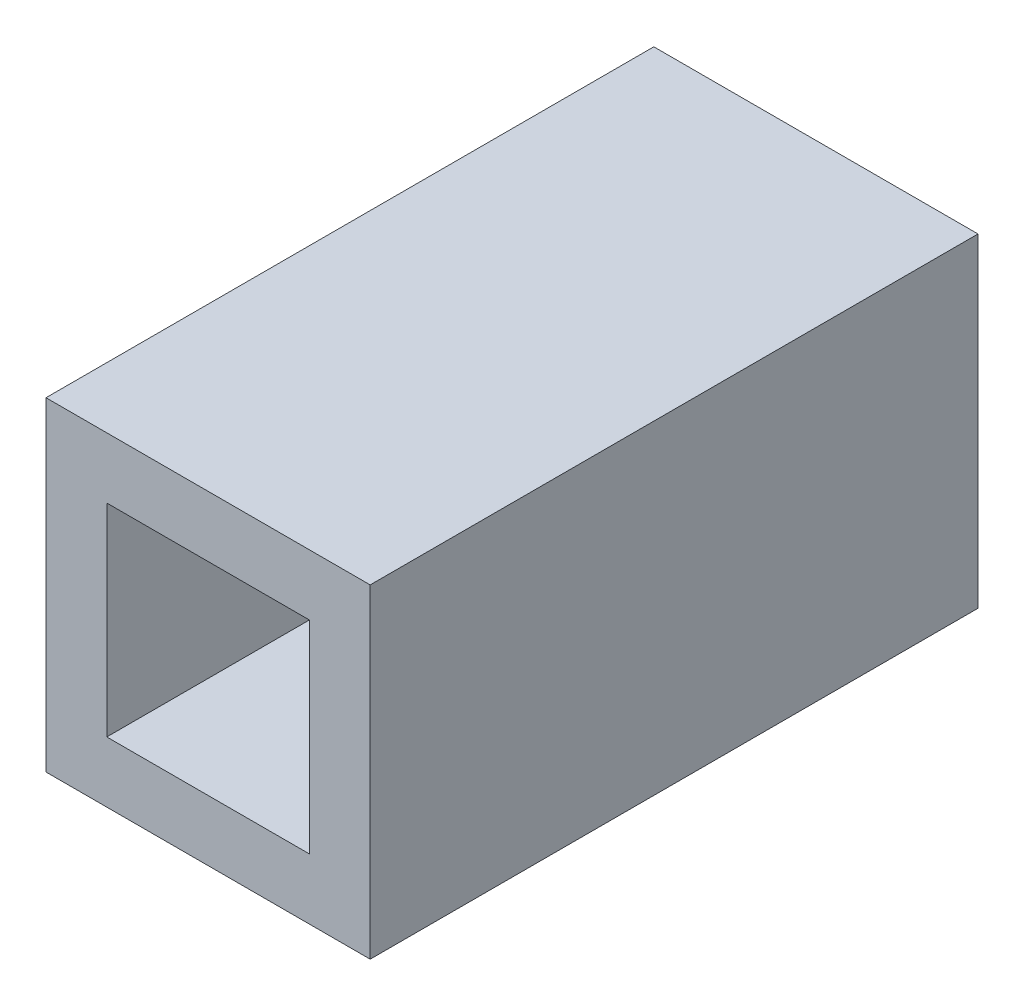
from build123d import *

# Parameters (mm, degrees)
SKETCH1_W           = 80
SKETCH1_H           = 80
SKETCH1_W_2         = 50
SKETCH1_H_2         = 50
BOSS_EXTRUDE1_DEPTH = 150
SKETCH2_R           = 5
CUT_EXTRUDE1_DEPTH  = 5


with BuildPart() as part:
    # Sketch1 → Boss-Extrude1 (new body)
    with BuildSketch(Plane.XY):
        Rectangle(SKETCH1_W, SKETCH1_H)
        Rectangle(SKETCH1_W_2, SKETCH1_H_2, mode=Mode.SUBTRACT)
    extrude(amount=BOSS_EXTRUDE1_DEPTH)

    # Sketch2 → Cut-Extrude1 (cut)
    with BuildSketch(Plane.ZY.offset(40)):
        with Locations(Location((75, 0, 0), (0, 0, 270))):
            Circle(SKETCH2_R)
    extrude(amount=-CUT_EXTRUDE1_DEPTH, mode=Mode.SUBTRACT)


solid = part.part
